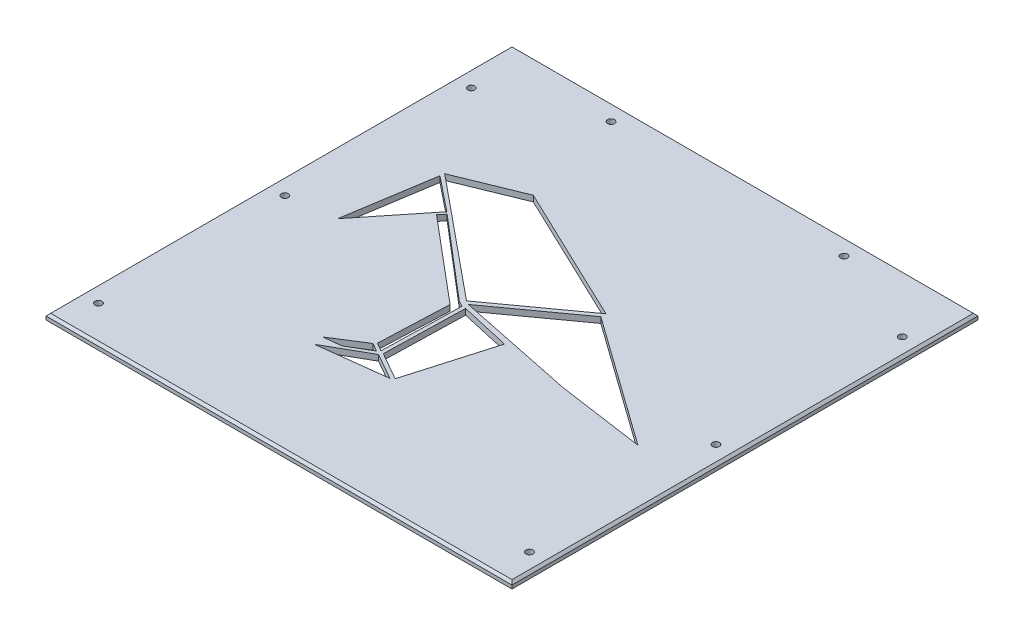
from build123d import *

# Parameters (mm, degrees)
CROQUIS1_W              = 400
CROQUIS1_H              = 400
CROQUIS1_R              = 3
SALIENTE_EXTRUIR1_DEPTH = 5
CHAFL_N1_SIZE           = 2
CORTAR_EXTRUIR1_DEPTH   = 10


with BuildPart() as part:
    # Croquis1 → Saliente-Extruir1 (new body)
    with BuildSketch(Plane(origin=(0, 0, 0), x_dir=(1, 0, 0), z_dir=(0, 1, 0))):
        with Locations((11.673151751, -29.571984436)):
            Rectangle(CROQUIS1_W, CROQUIS1_H)
        with Locations(Location((-173.326848249, 120.428015564, 0), (0, 0, 270))):
            Circle(CROQUIS1_R, mode=Mode.SUBTRACT)
        with Locations(Location((-173.326848249, -199.571984436, 0), (0, 0, 270))):
            Circle(CROQUIS1_R, mode=Mode.SUBTRACT)
        with Locations(Location((196.673151751, -199.571984436, 0), (0, 0, 270))):
            Circle(CROQUIS1_R, mode=Mode.SUBTRACT)
        with Locations(Location((196.673151751, 120.428015564, 0), (0, 0, 270))):
            Circle(CROQUIS1_R, mode=Mode.SUBTRACT)
        with Locations(Location((-173.326848249, -39.571984436, 0), (0, 0, 270))):
            Circle(CROQUIS1_R, mode=Mode.SUBTRACT)
        with Locations(Location((196.673151751, -39.571984436, 0), (0, 0, 270))):
            Circle(CROQUIS1_R, mode=Mode.SUBTRACT)
        with Locations(Location((-88.326848249, 155.428015564, 0), (0, 0, 270))):
            Circle(CROQUIS1_R, mode=Mode.SUBTRACT)
        with Locations(Location((111.673151751, 155.428015564, 0), (0, 0, 270))):
            Circle(CROQUIS1_R, mode=Mode.SUBTRACT)
    extrude(amount=SALIENTE_EXTRUIR1_DEPTH)

    # Chaflán1
    chafl_n1_edges = [part.edges().sort_by_distance(p)[0] for p in [
        (211.673151751, 5, 29.571984436),
        (11.673151751, 5, -170.428015564),
        (-188.326848249, 5, 29.571984436),
        (11.673151751, 5, 229.571984436),
    ]]
    chamfer(chafl_n1_edges, length=CHAFL_N1_SIZE)

    # Croquis2 → Cortar-Extruir1 (cut)
    with BuildSketch(Plane(origin=(0, 5, 0), x_dir=(1, 0, 0), z_dir=(0, 1, 0))):
        Polygon((-91.777504567, 17.93962644), (-133.486350664, -34.097124404), (-121.499339941, 41.762471587), align=None)
        Polygon((-120.940367697, 45.29991804), (-66.966286679, 67.345973172), (52.354078092, 10.388168385), (-17.091461921, -39.85772233), align=None)
        Polygon((163.775185266, -73.593412395), (52.354078092, 6.009139456), (-13.604376997, -41.724802745), (89.090925469, -62.956955386), align=None)
        Polygon((31.311804468, -55.660536224), (10.169460209, -128.358580052), (-13.558867473, -114.834434958), (-11.835173214, -45.882080038), align=None)
        Polygon((7.646392173, -130.362582514), (-49.989323249, -137.40209781), (-15.003820451, -117.452917491), align=None)
        Polygon((-94.005890503, 11.316220426), (-21.421222894, -49.654322149), (-23.868784692, -109.619586204), (-16.697922209, -113.650656174), (-15.003820451, -45.882080038), (-19.79537186, -43.31560542), (-89.832558674, 16.28451972), align=None)
        Polygon((-25.572304789, -111.697520158), (-51.931593577, -128.358580052), (-37.17095608, -126.84931671), (-18.323489891, -115.772410748), align=None)
    extrude(amount=-CORTAR_EXTRUIR1_DEPTH, mode=Mode.SUBTRACT)


solid = part.part
